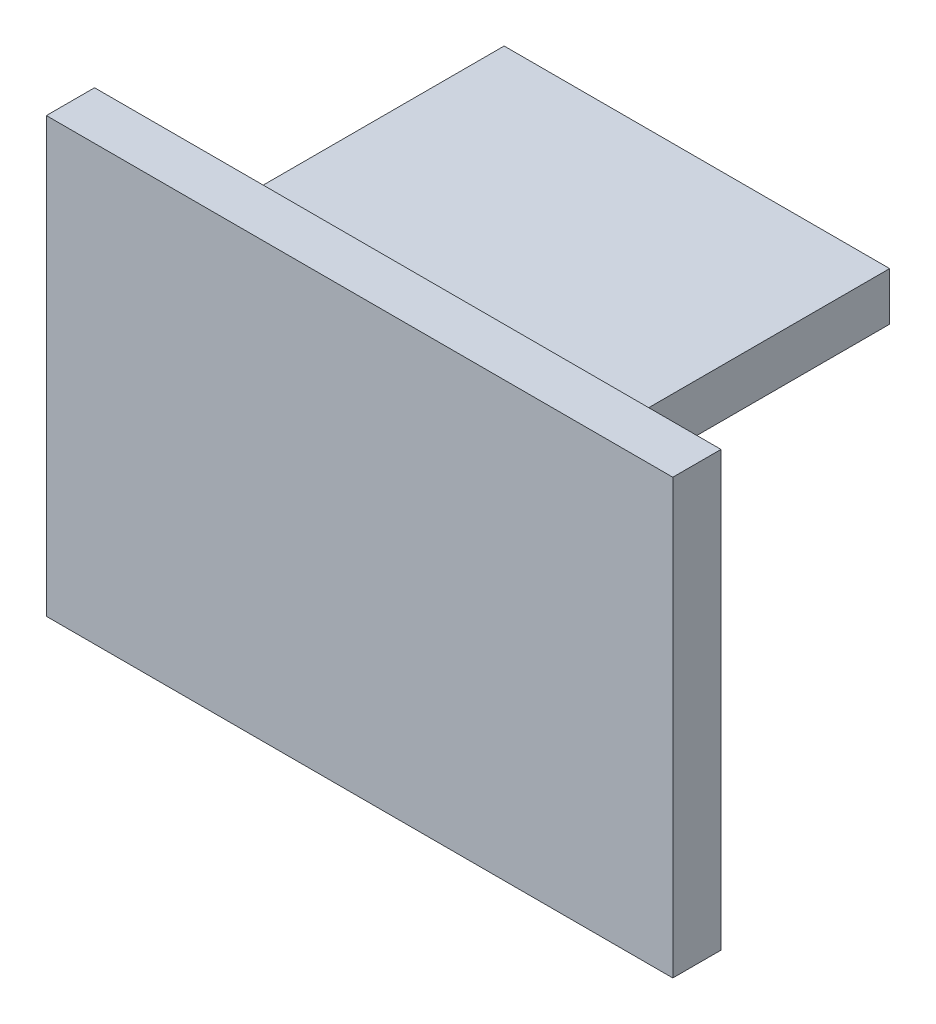
from build123d import *

# Parameters (mm, degrees)
SKETCH1_W           = 26
SKETCH1_H           = 18
BOSS_EXTRUDE1_DEPTH = 2
SKETCH2_W           = 16
SKETCH2_H           = 2
BOSS_EXTRUDE2_DEPTH = 12


with BuildPart() as part:
    # Sketch1 → Boss-Extrude1 (new body)
    with BuildSketch(Plane.XY):
        with Locations((0, 9)):
            Rectangle(SKETCH1_W, SKETCH1_H)
    extrude(amount=BOSS_EXTRUDE1_DEPTH)

    # Sketch2 → Boss-Extrude2 (add)
    with BuildSketch(Plane(origin=(0, 0, 0), x_dir=(-1, 0, 0), z_dir=(0, 0, -1))):
        with Locations((0, 15)):
            Rectangle(SKETCH2_W, SKETCH2_H)
    extrude(amount=BOSS_EXTRUDE2_DEPTH)


solid = part.part
